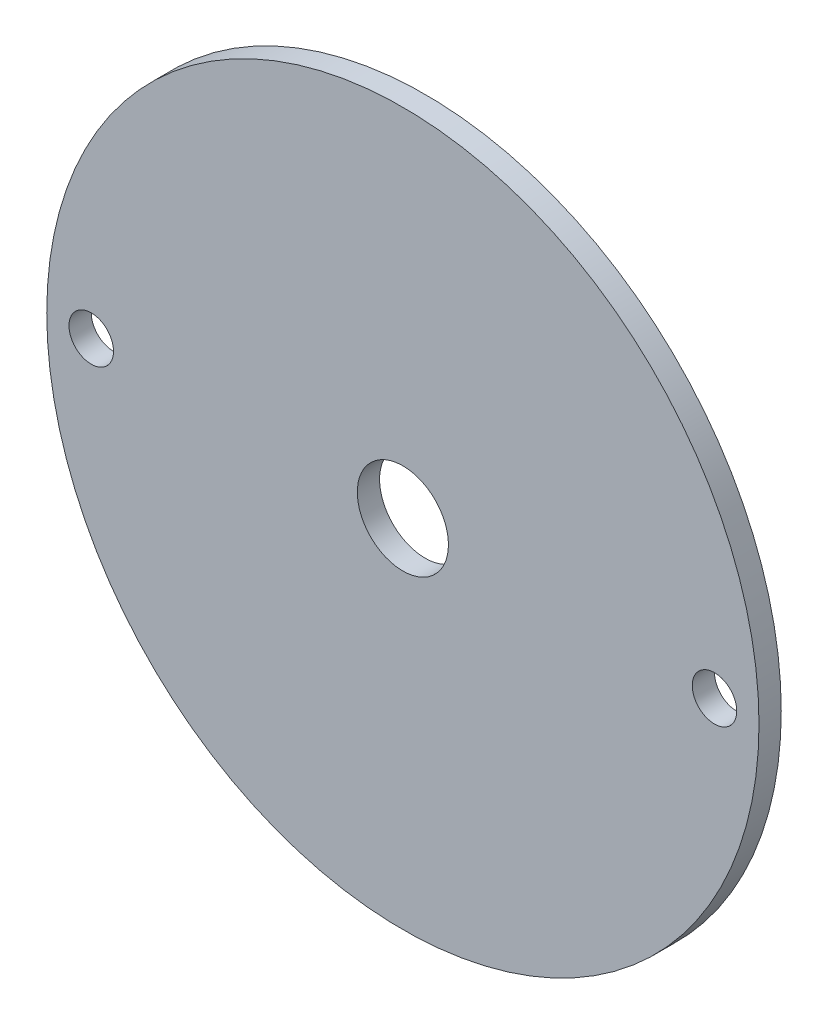
from build123d import *

# Parameters (mm, degrees)
SKETCH1_R           = 50.8
SKETCH1_R_2         = 3.175
SKETCH1_R_3         = 6.5
BOSS_EXTRUDE1_DEPTH = 3.175


with BuildPart() as part:
    # Sketch1 → Boss-Extrude1 (new body)
    with BuildSketch(Plane.XY):
        Circle(SKETCH1_R)
        with Locations((44.45, 0)):
            Circle(SKETCH1_R_2, mode=Mode.SUBTRACT)
        with Locations((-44.45, 0)):
            Circle(SKETCH1_R_2, mode=Mode.SUBTRACT)
        Circle(SKETCH1_R_3, mode=Mode.SUBTRACT)
    extrude(amount=BOSS_EXTRUDE1_DEPTH)


solid = part.part
